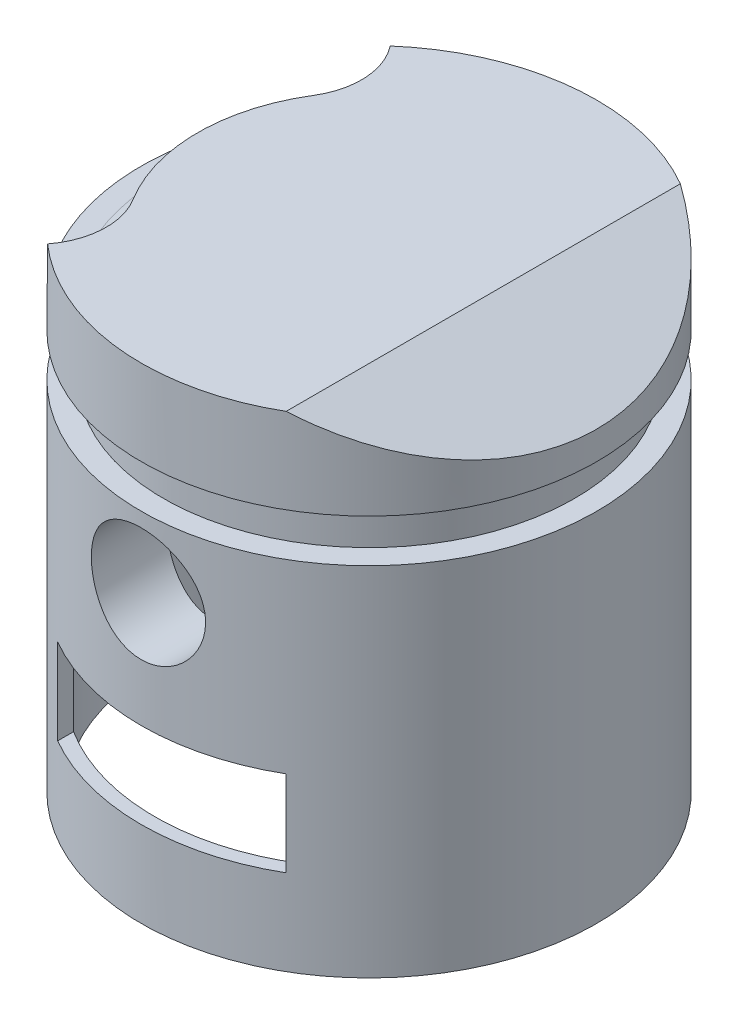
from build123d import *

# Parameters (mm, degrees)
CUT_EXTRUDE1_DEPTH      = 33.377264527
CUT_EXTRUDE1_DEPTH_BACK = 33.377264527
SKETCH13_R              = 3.175
CUT_EXTRUDE2_DEPTH      = 33.377264605
CUT_EXTRUDE2_DEPTH_BACK = 33.377264605
SKETCH14_W              = 12.7
SKETCH14_H              = 4.7625
CUT_EXTRUDE3_DEPTH      = 33.377264605
CUT_EXTRUDE3_DEPTH_BACK = 19.05
CUT_EXTRUDE5_START      = -3.175
CUT_EXTRUDE5_DEPTH      = 3.175
FILLET3_R               = 1.984375
CUT_EXTRUDE4_DEPTH      = 46.545358174


with BuildPart() as part:
    # Sketch1 → Revolve1 (revolve)
    with BuildSketch(Plane.XY, mode=Mode.PRIVATE) as revolve1_sk:
        Polygon((0, 26.9748), (12.6619, 26.9748), (12.6619, 22.23135), (11.43, 22.23135), (11.43, 19.84375), (12.6619, 19.84375), (12.6619, 0), (11.90625, 0), (11.90625, 11.90625), (8.73125, 11.90625), (8.73125, 23.8125), (0, 23.8125), align=None)
    revolve(revolve1_sk.sketch.rotate(Axis((0, -1015.176230553, 0), (0, 1, 0)), 90), axis=Axis((0, -1015.176230553, 0), (0, 1, 0)))

    # Sketch13 → Cut-Extrude1 (cut, two sides: drawn at the far end of the back side and taken through both)
    with BuildSketch(Plane.XY.offset(-CUT_EXTRUDE1_DEPTH_BACK)):
        with Locations((0, 15.875)):
            Circle(SKETCH13_R)
    extrude(amount=CUT_EXTRUDE1_DEPTH + CUT_EXTRUDE1_DEPTH_BACK, mode=Mode.SUBTRACT)

    # Sketch14 → Cut-Extrude2 (cut, two sides: drawn at the far end of the back side and taken through both)
    with BuildSketch(Plane.XY.offset(-CUT_EXTRUDE2_DEPTH_BACK)):
        with Locations((0, 7.14375)):
            Rectangle(SKETCH14_W, SKETCH14_H)
    extrude(amount=CUT_EXTRUDE2_DEPTH + CUT_EXTRUDE2_DEPTH_BACK, mode=Mode.SUBTRACT)

    # Sketch15 → Cut-Extrude3 (cut, two sides: drawn at the far end of the back side and taken through both)
    with BuildSketch(Plane.XZ.offset(-CUT_EXTRUDE3_DEPTH_BACK)):
        with BuildLine():
            ThreePointArc((7.9375, 8.874394786), (4.575121043, 8.687015829), (4.7625, 5.324636871))
            ThreePointArc((4.7625, 5.324636871), (7.14375, 0), (4.7625, -5.324636871))
            ThreePointArc((4.7625, -5.324636871), (4.575121043, -8.687015829), (7.9375, -8.874394786))
            ThreePointArc((7.9375, -8.874394786), (11.90625, 0), (7.9375, 8.874394786))
        make_face()
        with BuildLine():
            ThreePointArc((-4.7625, 5.324636871), (-7.14375, 0), (-4.7625, -5.324636871))
            ThreePointArc((-4.7625, -5.324636871), (-4.575121043, -8.687015829), (-7.9375, -8.874394786))
            ThreePointArc((-7.9375, -8.874394786), (-11.90625, 0), (-7.9375, 8.874394786))
            ThreePointArc((-7.9375, 8.874394786), (-4.575121043, 8.687015829), (-4.7625, 5.324636871))
        make_face()
    extrude(amount=CUT_EXTRUDE3_DEPTH + CUT_EXTRUDE3_DEPTH_BACK, mode=Mode.SUBTRACT)

    # Sketch16 → Cut-Extrude5 (cut)
    with BuildSketch(Plane(origin=(0, 26.9748, 0), x_dir=(1, 0, 0), z_dir=(0, 1, 0)).offset(CUT_EXTRUDE5_START)):
        with BuildLine():
            ThreePointArc((-8.102829044, 5.006973784), (-7.515832375, 7.303491278), (-8.34254677, 9.525))
            ThreePointArc((-8.34254677, 9.525), (-12.6619, 0), (-8.34254677, -9.525))
            ThreePointArc((-8.34254677, -9.525), (-7.515832375, -7.303491278), (-8.102829044, -5.006973784))
            ThreePointArc((-8.102829044, -5.006973784), (-9.525, 0), (-8.102829044, 5.006973784))
        make_face()
    extrude(amount=CUT_EXTRUDE5_DEPTH, mode=Mode.SUBTRACT)

    # Fillet3
    fillet3_edges = [part.edges().sort_by_distance(p)[0] for p in [
        (-7.515832375, 23.7998, 7.303491278),
        (-7.515832375, 23.7998, -7.303491278),
        (-9.525, 23.7998, 0),
    ]]
    fillet(fillet3_edges, radius=FILLET3_R)

    # 3DSketch2 → Cut-Extrude4 (cut, through all, along a direction that is not the sketch's normal)
    with BuildSketch(Plane(origin=(6.35, 26.9748, -10.954506452), x_dir=(0.2724106821506037, -0.13702750611197365, 0.9523738146436912), z_dir=(0.4493692675606063, 0.8933461039104856, 0))):
        Polygon((0, 0), (20.865570195, -6.68078041), (23.170530429, 0), (2.004022399, 6.777135294), align=None)
    extrude(amount=CUT_EXTRUDE4_DEPTH, dir=(0, 1, 0), mode=Mode.SUBTRACT)


solid = part.part
